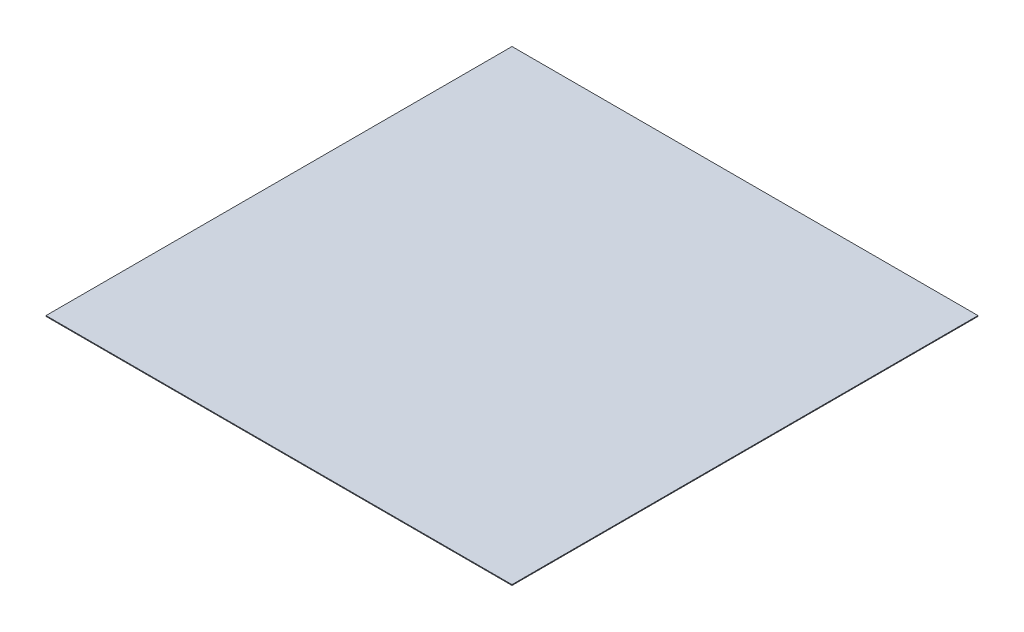
from build123d import *

# Parameters (mm, degrees)
SKETCH1_W           = 76.2
SKETCH1_H           = 76.2
BOSS_EXTRUDE1_DEPTH = 0.127


with BuildPart() as part:
    # Sketch1 → Boss-Extrude1 (new body)
    with BuildSketch(Plane(origin=(0, 0, 0), x_dir=(1, 0, 0), z_dir=(0, 1, 0))):
        Rectangle(SKETCH1_W, SKETCH1_H)
    extrude(amount=BOSS_EXTRUDE1_DEPTH)


solid = part.part
